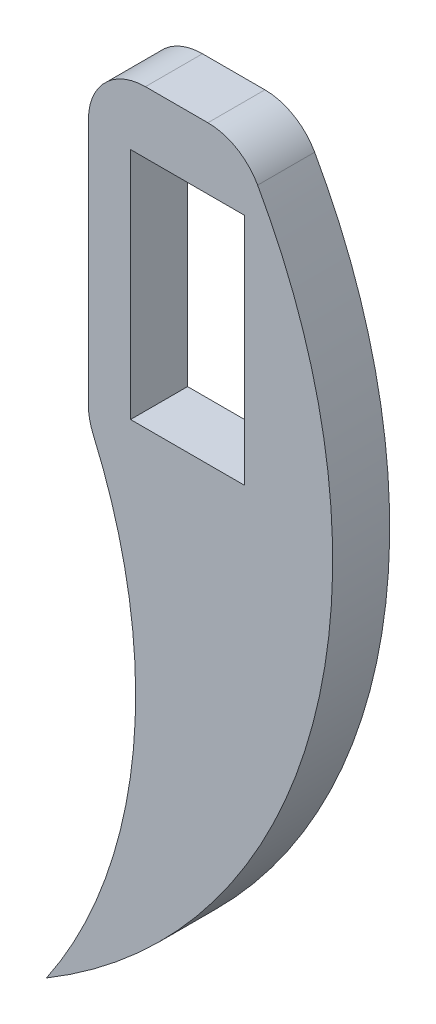
from build123d import *

# Parameters (mm, degrees)
ESQUISSE1_W        = 20
ESQUISSE1_H        = 41
BOSS_EXTRU_1_DEPTH = 10
CONG_1_R           = 10
CONG_2_R           = 10


with BuildPart() as part:
    # Esquisse1 → Boss.-Extru.1 (new body)
    with BuildSketch(Plane.XY):
        with BuildLine():
            Line((-7.391944515, 10.850266565), (19.223939946, 10.850266565))
            ThreePointArc((19.223939946, 10.850266565), (32.688147419, -68.35721731), (-14.757789944, -133.195426819))
            ThreePointArc((-14.757789944, -133.195426819), (0.583223132, -89.904856397), (-7.391944515, -44.674149232))
            Line((-7.391944515, -44.674149232), (-7.391944515, 10.850266565))
        make_face()
        with Locations((10, -20.5)):
            Rectangle(ESQUISSE1_W, ESQUISSE1_H, mode=Mode.SUBTRACT)
    extrude(amount=BOSS_EXTRU_1_DEPTH)

    # Congé1
    cong_1_edges = [part.edges().sort_by_distance(p)[0] for p in [
        (19.223939946, 10.850266565, 5),
    ]]
    fillet(cong_1_edges, radius=CONG_1_R)

    # Congé2
    cong_2_edges = [part.edges().sort_by_distance(p)[0] for p in [
        (-7.391944515, -44.674149232, 5),
        (-7.391944515, 10.850266565, 5),
    ]]
    fillet(cong_2_edges, radius=CONG_2_R)


solid = part.part
